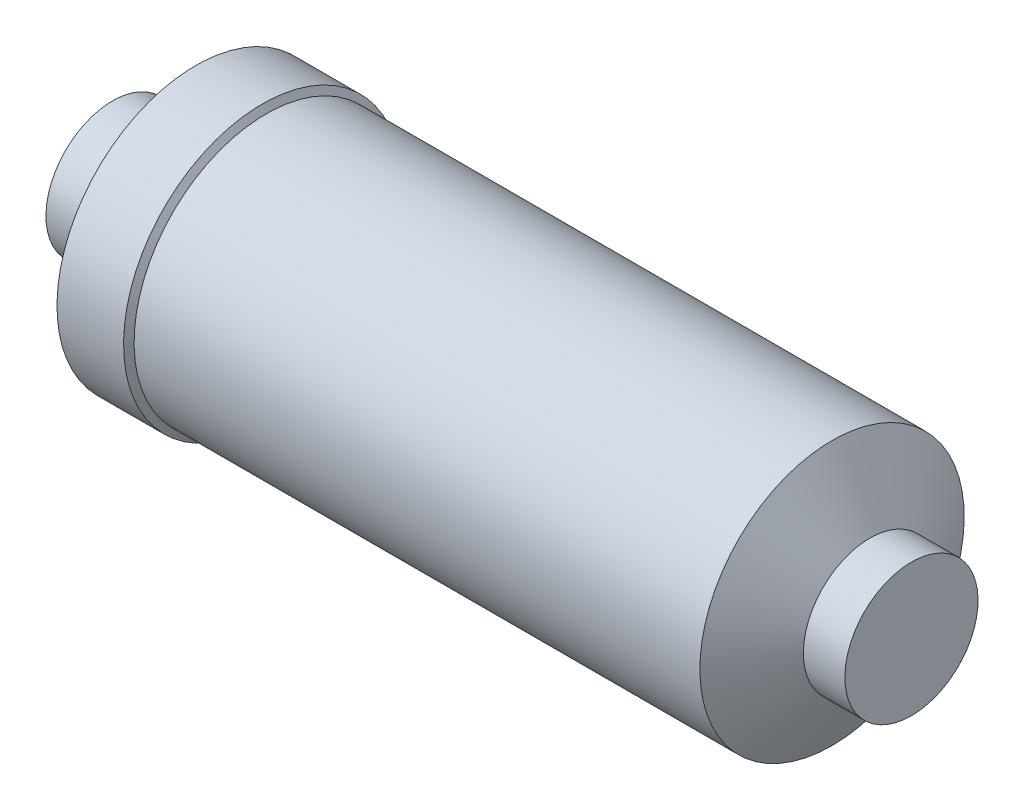
from build123d import *


with BuildPart() as part:
    # Sketch3 → Revolve1 (revolve)
    with BuildSketch(Plane.XY, mode=Mode.PRIVATE) as revolve1_sk:
        Polygon((-76.2, 0), (-76.2, 12.7), (-68.2752, 12.7), (-60.319601966, 26.4795), (-47.619601966, 26.4795), (-46.886367124, 25.2095), (61.052836808, 25.2095), (68.2752, 12.7), (76.2, 12.7), (76.2, 0), align=None)
    revolve(revolve1_sk.sketch.rotate(Axis((-76.2, 0, 0), (1, 0, 0)), 180), axis=Axis((-76.2, 0, 0), (1, 0, 0)))


solid = part.part
